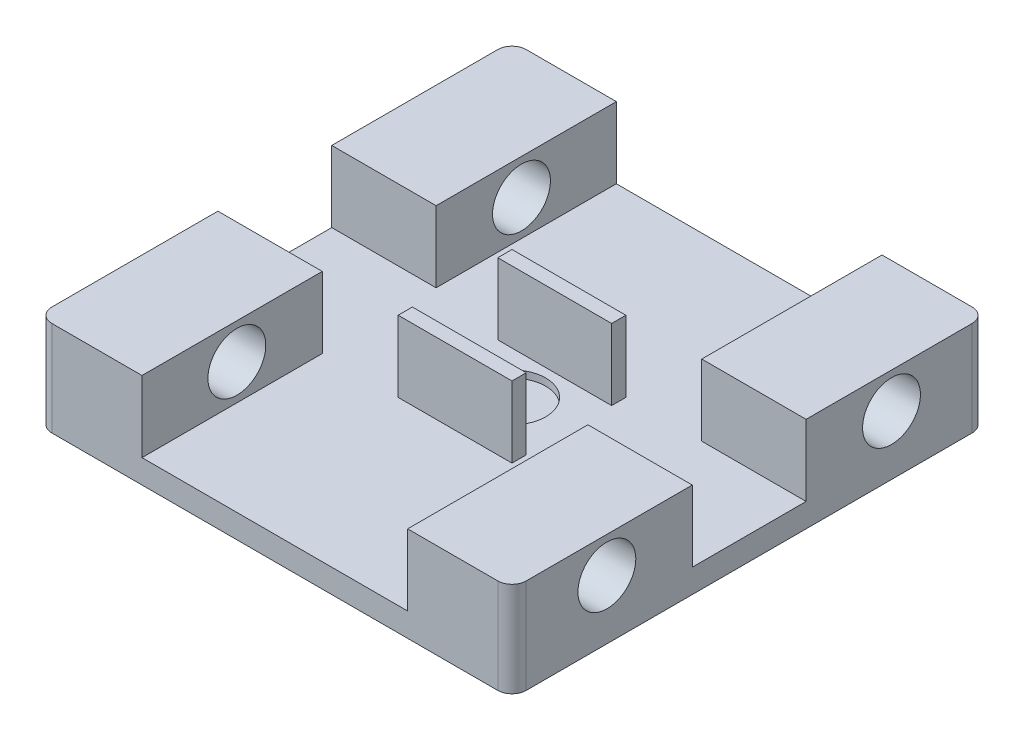
from build123d import *

# Parameters (mm, degrees)
SKETCH1_W               = 100
SKETCH1_H               = 100
BOSS_EXTRUDE1_DEPTH     = 20
SKETCH3_R               = 7.1
CUT_EXTRUDE1_DEPTH      = 16.5
CUT_EXTRUDE4_DEPTH      = 74.484692283
CUT_EXTRUDE4_DEPTH_BACK = 74.484692283
SKETCH7_R               = 6.1
FILLET1_R               = 3
SKETCH11_W              = 24
SKETCH11_H              = 24
CUT_EXTRUDE6_DEPTH      = 15
SKETCH12_W              = 18
SKETCH12_H              = 15
CUT_EXTRUDE7_DEPTH      = 32


with BuildPart() as part:
    # Sketch1 → Boss-Extrude1 (new body)
    with BuildSketch(Plane(origin=(0, 0, 0), x_dir=(1, 0, 0), z_dir=(0, 1, 0))):
        Rectangle(SKETCH1_W, SKETCH1_H)
    extrude(amount=BOSS_EXTRUDE1_DEPTH)

    # Sketch3 → Cut-Extrude1 (cut)
    with BuildSketch(Plane(origin=(0, 20, 0), x_dir=(1, 0, 0), z_dir=(0, 1, 0))):
        with Locations(Location((0, 0, 0), (0, 0, 270))):
            Circle(SKETCH3_R)
    extrude(amount=-CUT_EXTRUDE1_DEPTH, mode=Mode.SUBTRACT)

    # Sketch7 → Cut-Extrude4 (cut, two sides: drawn at the far end of the back side and taken through both)
    with BuildSketch(Plane(origin=(0, 0, 0), x_dir=(0, 0, -1), z_dir=(1, 0, 0)).offset(-CUT_EXTRUDE4_DEPTH_BACK)):
        with Locations((30, 12.5)):
            Circle(SKETCH7_R)
        with Locations(Location((-30, 12.5, 0), (0, 0, 180))):
            Circle(SKETCH7_R)
    extrude(amount=CUT_EXTRUDE4_DEPTH + CUT_EXTRUDE4_DEPTH_BACK, mode=Mode.SUBTRACT)

    # Fillet1
    fillet1_edges = [part.edges().sort_by_distance(p)[0] for p in [
        (50, 10, 50),
        (-50, 10, 50),
        (-50, 10, -50),
        (50, 10, -50),
    ]]
    fillet(fillet1_edges, radius=FILLET1_R)

    # Sketch11 → Cut-Extrude6 (cut)
    with BuildSketch(Plane(origin=(0, 20, 0), x_dir=(1, 0, 0), z_dir=(0, 1, 0))):
        Polygon((-50, 12), (-28, 12), (-28, 50), (28, 50), (28, 12), (50, 12), (50, -12), (28, -12), (28, -50), (-28, -50), (-28, -12), (-50, -12), align=None)
        Rectangle(SKETCH11_W, SKETCH11_H, mode=Mode.SUBTRACT)
    extrude(amount=-CUT_EXTRUDE6_DEPTH, mode=Mode.SUBTRACT)

    # Sketch12 → Cut-Extrude7 (cut)
    with BuildSketch(Plane(origin=(12, 0, 0), x_dir=(0, 0, -1), z_dir=(1, 0, 0))):
        with Locations((0, 12.5)):
            Rectangle(SKETCH12_W, SKETCH12_H)
    extrude(amount=-CUT_EXTRUDE7_DEPTH, mode=Mode.SUBTRACT)


solid = part.part
